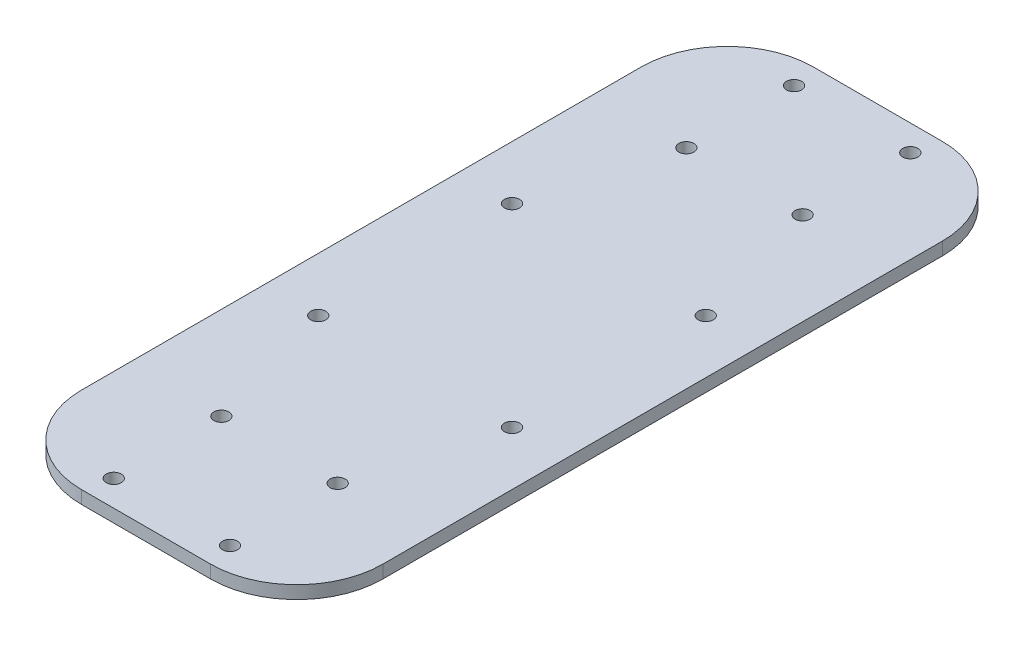
from build123d import *

# Parameters (mm, degrees)
SKETCH1_W           = 70
SKETCH1_H           = 170
SKETCH1_R           = 1.75
BOSS_EXTRUDE1_DEPTH = 3
SKETCH2_R           = 1.75
CUT_EXTRUDE2_DEPTH  = 92.972822073
FILLET1_R           = 20


with BuildPart() as part:
    # Sketch1 → Boss-Extrude1 (new body)
    with BuildSketch(Plane(origin=(0, 0, 0), x_dir=(1, 0, 0), z_dir=(0, 1, 0))):
        Rectangle(SKETCH1_W, SKETCH1_H)
        with Locations(Location((-22.5, 22.5, 0), (0, 0, 270))):
            Circle(SKETCH1_R, mode=Mode.SUBTRACT)
        with Locations(Location((22.5, 22.5, 0), (0, 0, 270))):
            Circle(SKETCH1_R, mode=Mode.SUBTRACT)
        with Locations(Location((-22.5, -22.5, 0), (0, 0, 90))):
            Circle(SKETCH1_R, mode=Mode.SUBTRACT)
        with Locations(Location((22.5, -22.5, 0), (0, 0, 90))):
            Circle(SKETCH1_R, mode=Mode.SUBTRACT)
    extrude(amount=BOSS_EXTRUDE1_DEPTH)

    # Sketch2 → Cut-Extrude2 (cut, through all)
    with BuildSketch(Plane(origin=(0, 0, 0), x_dir=(1, 0, 0), z_dir=(0, 1, 0))):
        with Locations(Location((-13.5, 79, 0), (0, 0, 270))):
            Circle(SKETCH2_R)
        with Locations(Location((13.5, 79, 0), (0, 0, 270))):
            Circle(SKETCH2_R)
        with Locations(Location((13.5, 54, 0), (0, 0, 270))):
            Circle(SKETCH2_R)
        with Locations(Location((-13.5, 54, 0), (0, 0, 270))):
            Circle(SKETCH2_R)
    cut_extrude2 = extrude(amount=CUT_EXTRUDE2_DEPTH, mode=Mode.SUBTRACT)

    # Mirror1: Cut-Extrude2 across plane
    add(cut_extrude2.mirror(Plane.XY), mode=Mode.SUBTRACT)

    # Fillet1
    fillet1_edges = [part.edges().sort_by_distance(p)[0] for p in [
        (35, 1.5, -85),
        (35, 1.5, 85),
        (-35, 1.5, 85),
        (-35, 1.5, -85),
    ]]
    fillet(fillet1_edges, radius=FILLET1_R)


solid = part.part
